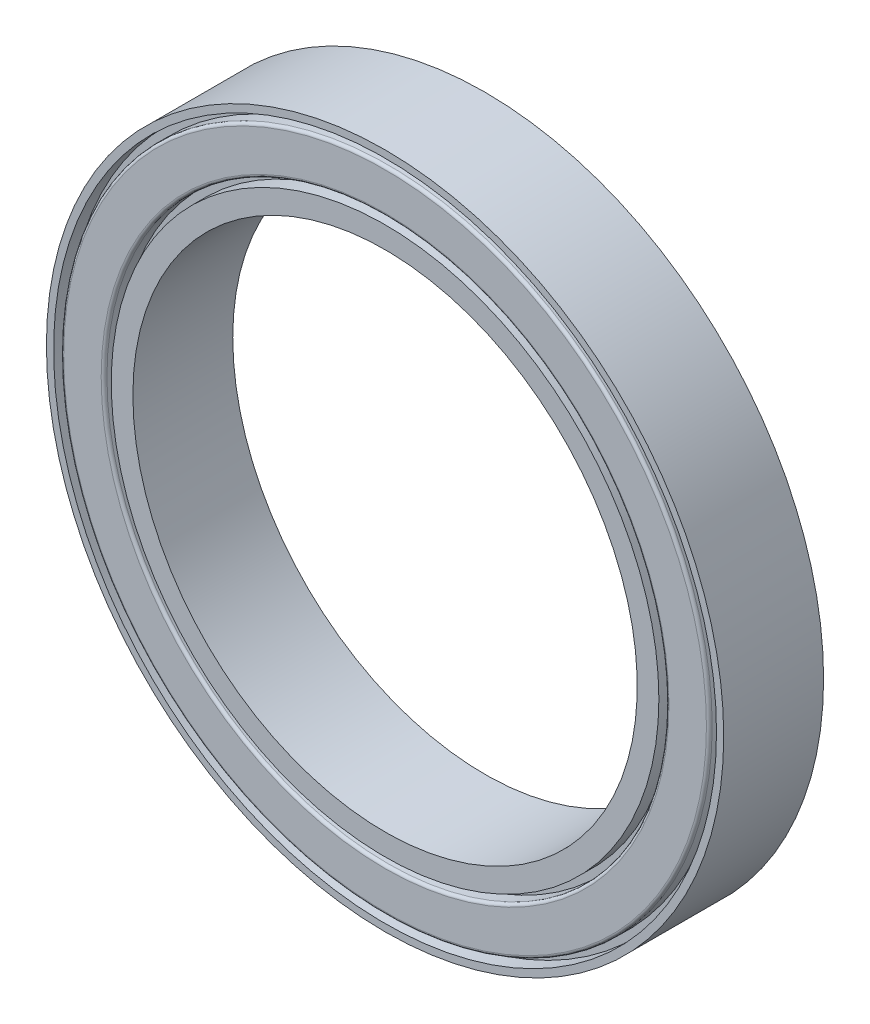
from build123d import *

# Parameters (mm, degrees)
SKETCH1_R           = 23.5
SKETCH1_R_2         = 17.5
BOSS_EXTRUDE1_DEPTH = 6.93
SKETCH2_R           = 23
SKETCH2_R_2         = 22.5
CUT_EXTRUDE1_DEPTH  = 1
SKETCH3_R           = 19.5
SKETCH3_R_2         = 19
CUT_EXTRUDE2_DEPTH  = 1
FILLET1_R           = 0.2


with BuildPart() as part:
    # Sketch1 → Boss-Extrude1 (new body)
    with BuildSketch(Plane.XY):
        with Locations(Location((0, 0, 0), (0, 0, 180))):
            Circle(SKETCH1_R)
        with Locations(Location((0, 0, 0), (0, 0, 180))):
            Circle(SKETCH1_R_2, mode=Mode.SUBTRACT)
    extrude(amount=BOSS_EXTRUDE1_DEPTH)

    # Sketch2 → Cut-Extrude1 (cut)
    with BuildSketch(Plane.XY.offset(6.93)):
        Circle(SKETCH2_R)
        Circle(SKETCH2_R_2, mode=Mode.SUBTRACT)
    cut_extrude1 = extrude(amount=-CUT_EXTRUDE1_DEPTH, mode=Mode.SUBTRACT)

    # Sketch3 → Cut-Extrude2 (cut)
    with BuildSketch(Plane.XY.offset(6.93)):
        Circle(SKETCH3_R)
        Circle(SKETCH3_R_2, mode=Mode.SUBTRACT)
    cut_extrude2 = extrude(amount=-CUT_EXTRUDE2_DEPTH, mode=Mode.SUBTRACT)

    # Mirror1: Cut-Extrude1, Cut-Extrude2 across plane
    add(cut_extrude1.mirror(Plane.XY.offset(3.465)), mode=Mode.SUBTRACT)
    add(cut_extrude2.mirror(Plane.XY.offset(3.465)), mode=Mode.SUBTRACT)

    # Fillet1
    fillet1_edges = [part.edges().sort_by_distance(p)[0] for p in [
        (-22.5, 0, 6.93),
        (-19.5, 0, 6.93),
        (-22.5, 0, 0),
        (-19.5, 0, 0),
    ]]
    fillet(fillet1_edges, radius=FILLET1_R)


solid = part.part
